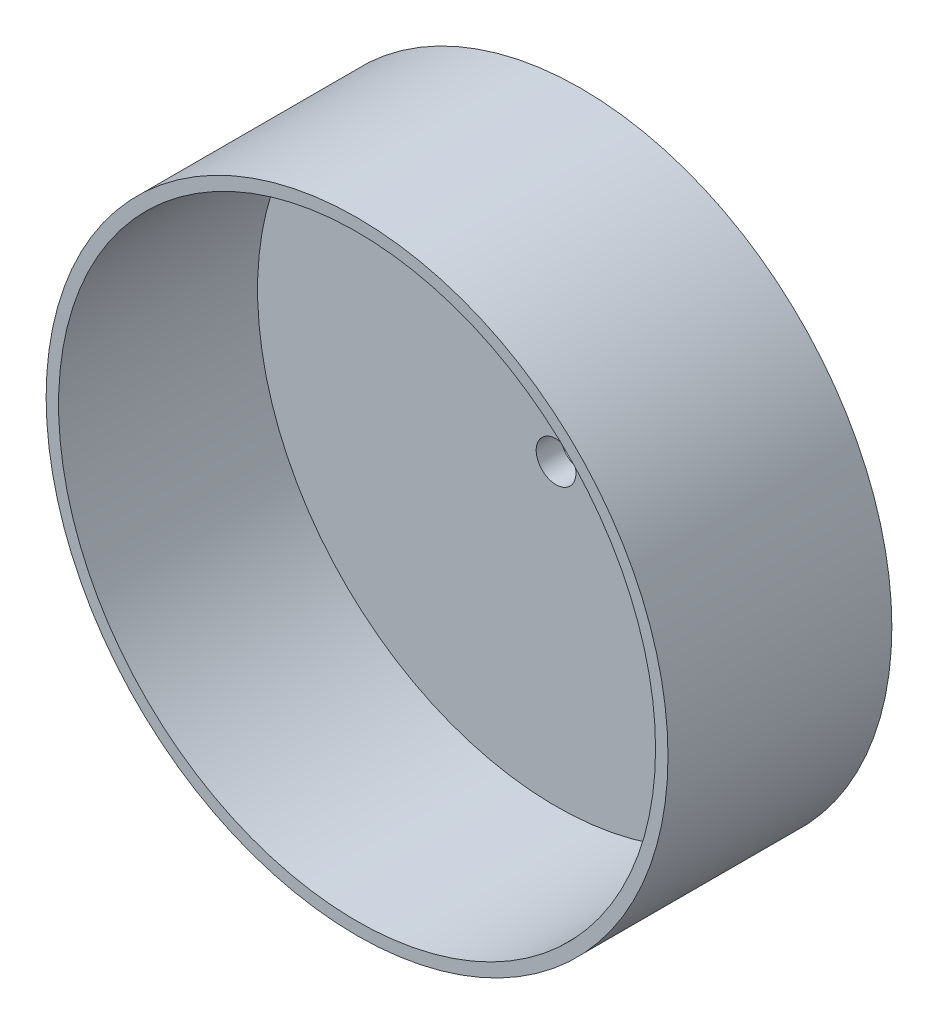
from build123d import *

# Parameters (mm, degrees)
SKETCH1_R           = 62.5
SKETCH1_R_2         = 4
BOSS_EXTRUDE1_DEPTH = 45
SKETCH2_R           = 60
CUT_EXTRUDE1_DEPTH  = 40


with BuildPart() as part:
    # Sketch1 → Boss-Extrude1 (new body)
    with BuildSketch(Plane.XY):
        with Locations(Location((0, 0, 0), (0, 0, 180))):
            Circle(SKETCH1_R)
        with Locations(Location((0, 0, 0), (0, 0, 180))):
            Circle(SKETCH1_R_2, mode=Mode.SUBTRACT)
    extrude(amount=BOSS_EXTRUDE1_DEPTH)

    # Sketch2 → Cut-Extrude1 (cut)
    with BuildSketch(Plane.XY.offset(45)):
        Circle(SKETCH2_R)
    extrude(amount=-CUT_EXTRUDE1_DEPTH, mode=Mode.SUBTRACT)


solid = part.part
